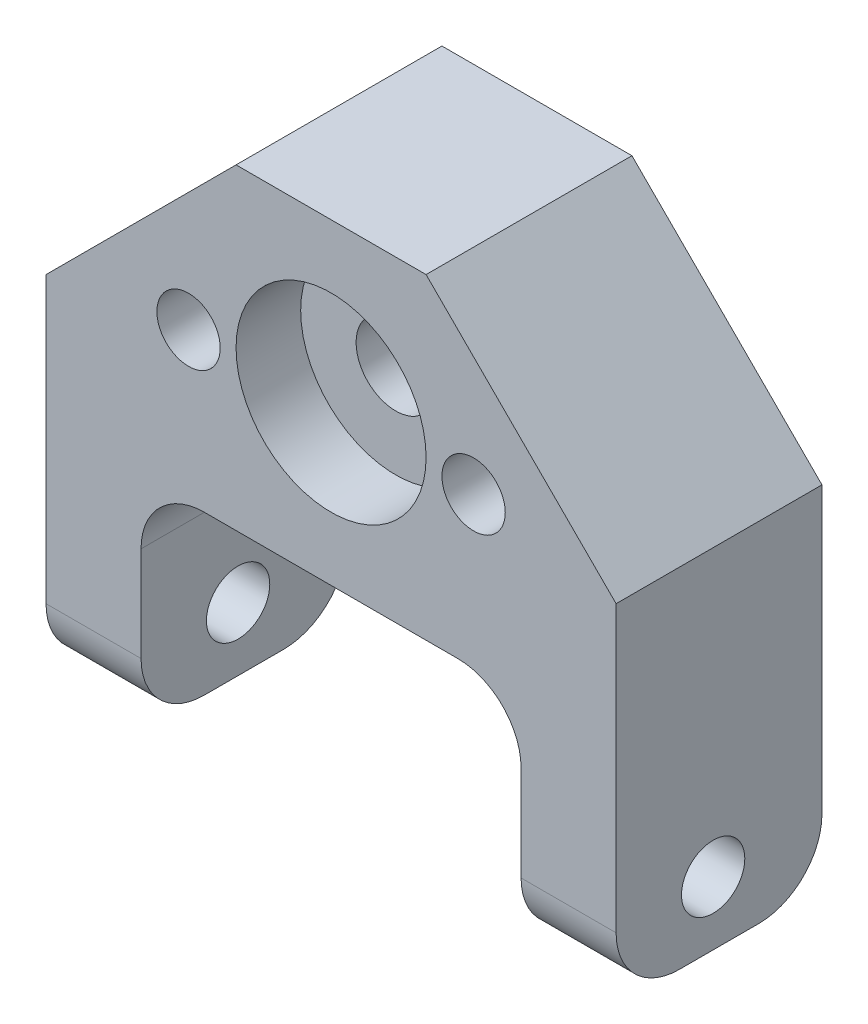
from build123d import *

# Parameters (mm, degrees)
SKETCH1_W                      = 57.15
SKETCH1_H                      = 31.75
BOSS_EXTRUDE1_DEPTH            = 20.6375
SKETCH2_R                      = 11.1125
CUT_EXTRUDE1_DEPTH             = 6.985
SKETCH3_R                      = 8.255
CUT_EXTRUDE2_DEPTH             = 2.413
SKETCH4_R                      = 3.96875
CUT_EXTRUDE3_DEPTH             = 35.56692943
CUT_EXTRUDE4_START             = -4.7625
SKETCH6_R                      = 9.525
CUT_EXTRUDE4_DEPTH             = 30.80442943
SKETCH7_W                      = 9.525
SKETCH7_H                      = 20.6375
BOSS_EXTRUDE2_DEPTH            = 22.225
SKETCH9_R                      = 3.175
CUT_EXTRUDE5_DEPTH             = 72.719166938
FILLET1_R                      = 6.35
F_1_4_0_2500_DOWEL_HOLE1_D     = 6.35
F_1_4_0_2500_DOWEL_HOLE1_DEPTH = 9.525
F_1_4_0_2500_DOWEL_HOLE1_TIP   = 1.907732465
FILLET3_R                      = 6.35
CHAMFER1_SIZE                  = 19.05


with BuildPart() as part:
    # Sketch1 → Boss-Extrude1 (new body)
    with BuildSketch(Plane.XY):
        Rectangle(SKETCH1_W, SKETCH1_H)
    extrude(amount=BOSS_EXTRUDE1_DEPTH)

    # Sketch2 → Cut-Extrude1 (cut)
    with BuildSketch(Plane(origin=(0, 0, 0), x_dir=(-1, 0, 0), z_dir=(0, 0, -1))):
        Circle(SKETCH2_R)
    extrude(amount=-CUT_EXTRUDE1_DEPTH, mode=Mode.SUBTRACT)

    # Sketch3 → Cut-Extrude2 (cut)
    with BuildSketch(Plane(origin=(0, 0, 6.985), x_dir=(-1, 0, 0), z_dir=(0, 0, -1))):
        Circle(SKETCH3_R)
    extrude(amount=-CUT_EXTRUDE2_DEPTH, mode=Mode.SUBTRACT)

    # Sketch4 → Cut-Extrude3 (cut, through all)
    with BuildSketch(Plane(origin=(0, 0, 9.398), x_dir=(-1, 0, 0), z_dir=(0, 0, -1))):
        Circle(SKETCH4_R)
    extrude(amount=-CUT_EXTRUDE3_DEPTH, mode=Mode.SUBTRACT)

    # Sketch6 → Cut-Extrude4 (cut, through all)
    with BuildSketch(Plane(origin=(0, 0, 9.398), x_dir=(-1, 0, 0), z_dir=(0, 0, -1)).offset(CUT_EXTRUDE4_START)):
        Circle(SKETCH6_R)
    extrude(amount=-CUT_EXTRUDE4_DEPTH, mode=Mode.SUBTRACT)

    # Sketch7 → Boss-Extrude2 (add)
    with BuildSketch(Plane.XZ.offset(15.875)):
        with Locations((-23.8125, 10.31875)):
            Rectangle(SKETCH7_W, SKETCH7_H)
        with Locations((23.8125, 10.31875)):
            Rectangle(SKETCH7_W, SKETCH7_H)
    extrude(amount=BOSS_EXTRUDE2_DEPTH)

    # Sketch9 → Cut-Extrude5 (cut, through all)
    with BuildSketch(Plane(origin=(28.575, 0, 0), x_dir=(0, 0, -1), z_dir=(1, 0, 0))):
        with Locations((-10.909520599, -31.75)):
            Circle(SKETCH9_R)
    extrude(amount=-CUT_EXTRUDE5_DEPTH, mode=Mode.SUBTRACT)

    # Fillet1
    fillet1_edges = [part.edges().sort_by_distance(p)[0] for p in [
        (-19.05, -15.875, 10.31875),
        (19.05, -15.875, 10.31875),
    ]]
    fillet(fillet1_edges, radius=FILLET1_R)

    # 1/4 (0.2500) Dowel Hole1
    with Locations(Plane.XY.offset(20.6375)):
        with Locations((-14.287572867, -0.8255), (14.287427022, -0.828020391)):
            Hole(F_1_4_0_2500_DOWEL_HOLE1_D / 2, depth=F_1_4_0_2500_DOWEL_HOLE1_DEPTH)
            with Locations((0, 0, -(F_1_4_0_2500_DOWEL_HOLE1_DEPTH + F_1_4_0_2500_DOWEL_HOLE1_TIP / 2))):  # 118° drill point
                Cone(0, F_1_4_0_2500_DOWEL_HOLE1_D / 2, F_1_4_0_2500_DOWEL_HOLE1_TIP, mode=Mode.SUBTRACT)

    # Fillet3
    fillet3_edges = [part.edges().sort_by_distance(p)[0] for p in [
        (-23.8125, -38.1, 0),
        (-23.8125, -38.1, 20.6375),
        (23.8125, -38.1, 20.6375),
        (23.8125, -38.1, 0),
    ]]
    fillet(fillet3_edges, radius=FILLET3_R)

    # Chamfer1
    chamfer1_edges = [part.edges().sort_by_distance(p)[0] for p in [
        (-28.575, 15.875, 10.31875),
        (28.575, 15.875, 10.31875),
    ]]
    chamfer(chamfer1_edges, length=CHAMFER1_SIZE)


solid = part.part
